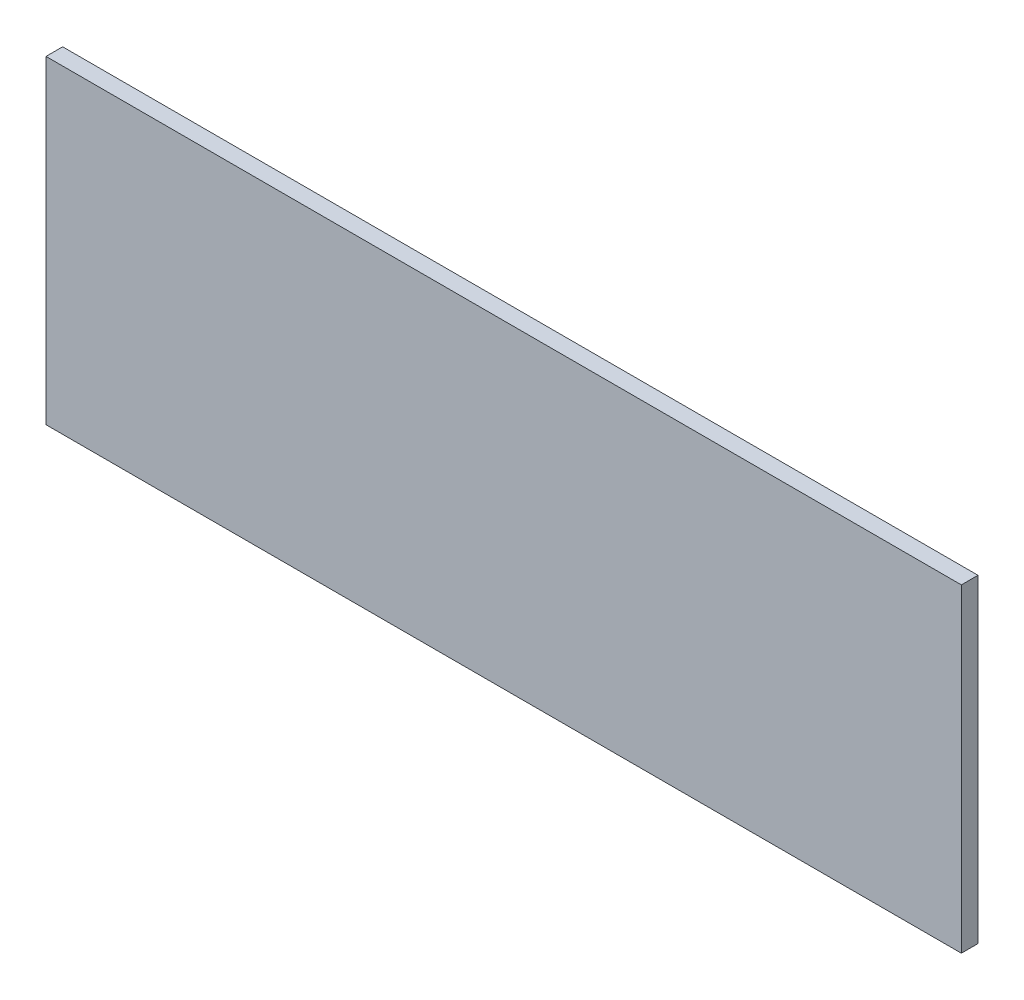
from build123d import *

# Parameters (mm, degrees)
ESQUISSE1_W        = 330
ESQUISSE1_H        = 115
BOSS_EXTRU_1_DEPTH = 6


with BuildPart() as part:
    # Esquisse1 → Boss.-Extru.1 (new body)
    with BuildSketch(Plane.XY):
        Rectangle(ESQUISSE1_W, ESQUISSE1_H)
    extrude(amount=BOSS_EXTRU_1_DEPTH)


solid = part.part
